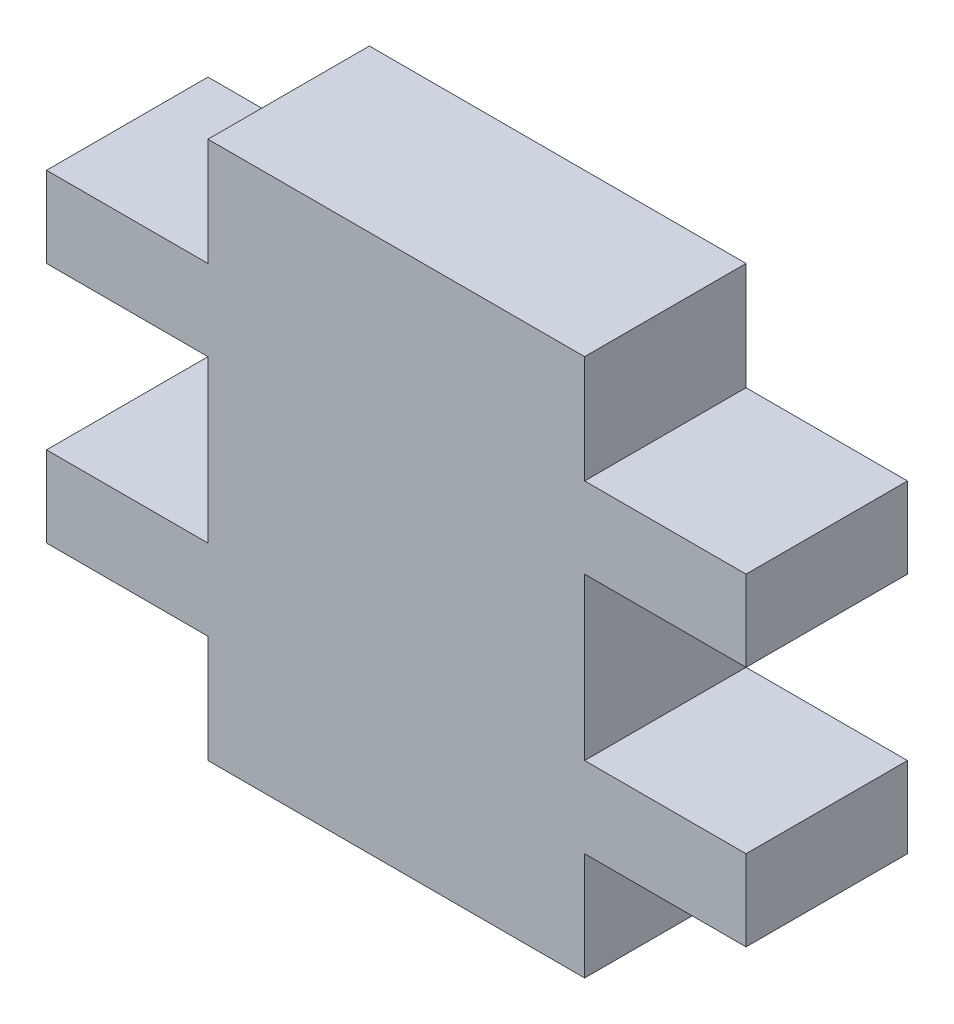
from build123d import *

# Parameters (mm, degrees)
SKETCH1_W           = 13
SKETCH1_H           = 10
BOSS_EXTRUDE1_DEPTH = 3
SKETCH2_W           = 3
SKETCH2_H           = 2
SKETCH2_H_2         = 3
CUT_EXTRUDE1_DEPTH  = 3
SKETCH3_W           = 3
SKETCH3_H           = 2
SKETCH3_H_2         = 3
CUT_EXTRUDE2_DEPTH  = 3


with BuildPart() as part:
    # Sketch1 → Boss-Extrude1 (new body)
    with BuildSketch(Plane.XY):
        Rectangle(SKETCH1_W, SKETCH1_H)
    extrude(amount=BOSS_EXTRUDE1_DEPTH)

    # Sketch2 → Cut-Extrude1 (cut)
    with BuildSketch(Plane.XY.offset(3)):
        with Locations((-5, 4)):
            Rectangle(SKETCH2_W, SKETCH2_H)
        with Locations((-5, 0)):
            Rectangle(SKETCH2_W, SKETCH2_H_2)
        with Locations((-5, -4)):
            Rectangle(SKETCH2_W, SKETCH2_H)
    extrude(amount=-CUT_EXTRUDE1_DEPTH, mode=Mode.SUBTRACT)

    # Sketch3 → Cut-Extrude2 (cut)
    with BuildSketch(Plane.XY.offset(3)):
        with Locations((5, 4)):
            Rectangle(SKETCH3_W, SKETCH3_H)
        with Locations((5, 0)):
            Rectangle(SKETCH3_W, SKETCH3_H_2)
        with Locations((5, -4)):
            Rectangle(SKETCH3_W, SKETCH3_H)
    extrude(amount=-CUT_EXTRUDE2_DEPTH, mode=Mode.SUBTRACT)


solid = part.part
